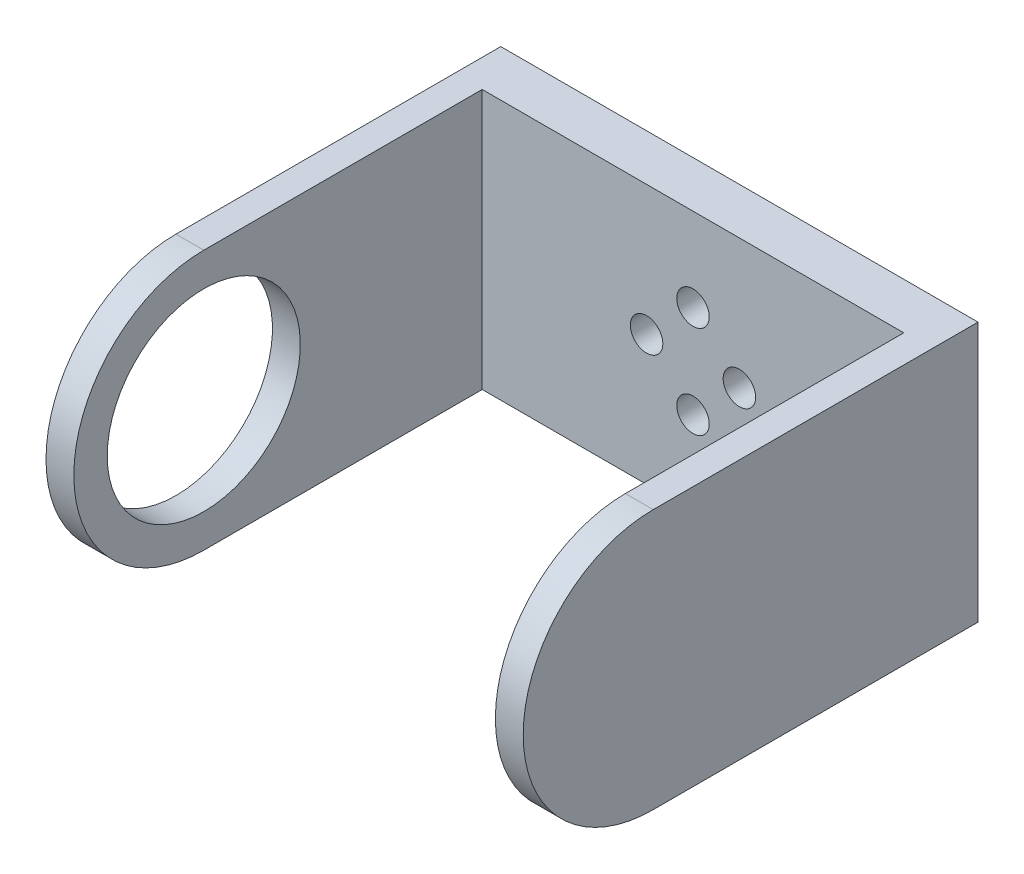
from build123d import *

# Parameters (mm, degrees)
SKETCH1_W           = 51.42
SKETCH1_H           = 28
BOSS_EXTRUDE1_DEPTH = 5
SKETCH3_W           = 3
SKETCH3_H           = 28
BOSS_EXTRUDE2_DEPTH = 30
BOSS_EXTRUDE4_DEPTH = 3
SKETCH6_R           = 10.4
CUT_EXTRUDE1_DEPTH  = 4
BOSS_EXTRUDE5_START = -3
BOSS_EXTRUDE5_DEPTH = 3
SKETCH8_R           = 1.75
CUT_EXTRUDE2_DEPTH  = 10


with BuildPart() as part:
    # Sketch1 → Boss-Extrude1 (new body)
    with BuildSketch(Plane.XY):
        Rectangle(SKETCH1_W, SKETCH1_H)
    extrude(amount=BOSS_EXTRUDE1_DEPTH)

    # Sketch3 → Boss-Extrude2 (add)
    with BuildSketch(Plane.XY.offset(5)):
        with Locations((-24.21, 0)):
            Rectangle(SKETCH3_W, SKETCH3_H)
        with Locations((24.21, 0)):
            Rectangle(SKETCH3_W, SKETCH3_H)
    extrude(amount=BOSS_EXTRUDE2_DEPTH)

    # Sketch5 → Boss-Extrude4 (add)
    with BuildSketch(Plane.ZY.offset(25.71)):
        with BuildLine():
            Line((35, -14), (35, 14))
            ThreePointArc((35, 14), (49, 0), (35, -14))
        make_face()
    extrude(amount=-BOSS_EXTRUDE4_DEPTH)

    # Sketch6 → Cut-Extrude1 (cut)
    with BuildSketch(Plane.ZY.offset(25.71)):
        with Locations(Location((35, 0, 0), (0, 0, 270))):
            Circle(SKETCH6_R)
    extrude(amount=-CUT_EXTRUDE1_DEPTH, mode=Mode.SUBTRACT)

    # Sketch7 → Boss-Extrude5 (add)
    with BuildSketch(Plane(origin=(25.71, 0, 0), x_dir=(0, 0, -1), z_dir=(1, 0, 0)).offset(BOSS_EXTRUDE5_START)):
        with BuildLine():
            Line((-35, 14), (-35, -14))
            ThreePointArc((-35, -14), (-49, 0), (-35, 14))
        make_face()
    extrude(amount=BOSS_EXTRUDE5_DEPTH)

    # Sketch8 → Cut-Extrude2 (cut)
    with BuildSketch(Plane(origin=(0, 0, 0), x_dir=(-1, 0, 0), z_dir=(0, 0, -1))):
        with Locations((0, 5)):
            Circle(SKETCH8_R)
        with Locations((-5, 0)):
            Circle(SKETCH8_R)
        with Locations(Location((5, 0, 0), (0, 0, 180))):
            Circle(SKETCH8_R)
        with Locations(Location((0, -5, 0), (0, 0, 180))):
            Circle(SKETCH8_R)
    extrude(amount=-CUT_EXTRUDE2_DEPTH, mode=Mode.SUBTRACT)


solid = part.part
